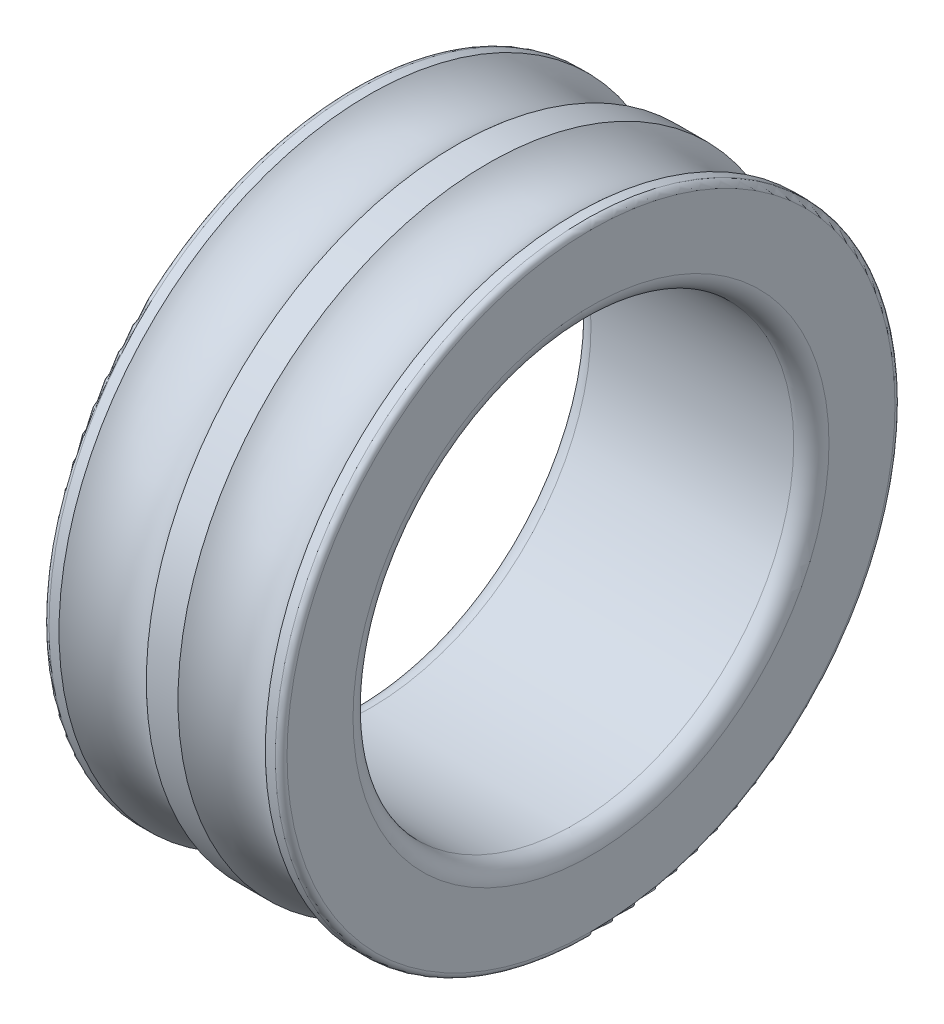
from build123d import *

# Parameters (mm, degrees)
FILLET1_R = 2
FILLET2_R = 0.666666667


with BuildPart() as part:
    # Sketch1 → Revolve1 (revolve)
    with BuildSketch(Plane.XY, mode=Mode.PRIVATE) as revolve1_sk:
        with BuildLine():
            Line((1.798294662, 35.15), (0, 35.15))
            Line((0, 35.15), (0, 25))
            Line((0, 25), (27, 25))
            Line((27, 25), (27, 35.15))
            Line((27, 35.15), (25.201705338, 35.15))
            ThreePointArc((25.201705338, 35.15), (20.25, 33.1555), (15.298294662, 35.15))
            Line((15.298294662, 35.15), (11.701705338, 35.15))
            ThreePointArc((11.701705338, 35.15), (6.75, 33.1555), (1.798294662, 35.15))
        make_face()
    revolve(revolve1_sk.sketch.rotate(Axis((0, 0, 0), (1, 0, 0)), 270), axis=Axis((0, 0, 0), (1, 0, 0)))

    # Fillet1
    fillet1_edges = [part.edges().sort_by_distance(p)[0] for p in [
        (0, 0, 25),
        (27, 0, 25),
    ]]
    fillet(fillet1_edges, radius=FILLET1_R)

    # Fillet2
    fillet2_edges = [part.edges().sort_by_distance(p)[0] for p in [
        (0, 0, 35.15),
        (27, 0, 35.15),
    ]]
    fillet(fillet2_edges, radius=FILLET2_R)


solid = part.part
